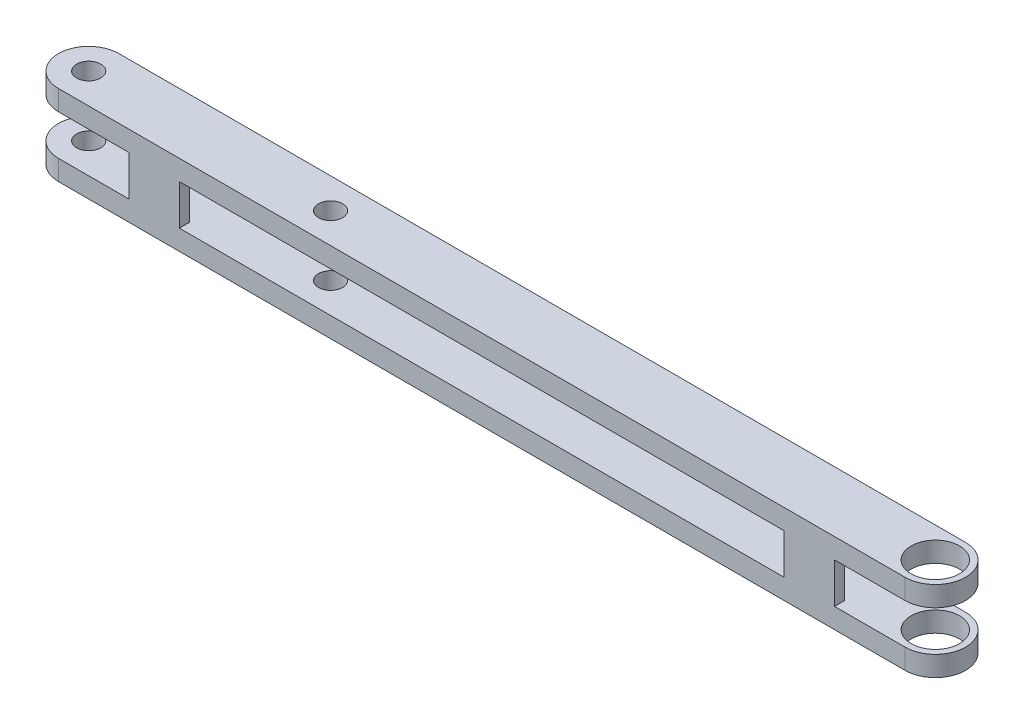
from build123d import *

# Parameters (mm, degrees)
EXTRUDE_1_DEPTH     = 20
SKETCH_2_W          = 150
SKETCH_2_H          = 10
CUT_EXTRUDE_3_DEPTH = 116.244305716
SKETCH_3_W          = 25
SKETCH_3_H          = 10
CUT_EXTRUDE_4_DEPTH = 116.244305716
SKETCH_4_W          = 10
SKETCH_4_H          = 10
CUT_EXTRUDE_5_DEPTH = 202.137390855
SKETCH_5_R          = 3
SKETCH_5_R_2        = 6
CUT_EXTRUDE_6_DEPTH = 115.509824906
SKETCH_6_R          = 3
CUT_EXTRUDE_7_DEPTH = 115.509824906


with BuildPart() as part:
    # 草图1 → 凸台-拉伸1 (new body)
    with BuildSketch(Plane(origin=(0, 0, 0), x_dir=(1, 0, 0), z_dir=(0, 1, 0))):
        with BuildLine():
            Line((-105, 7.5), (105, 7.5))
            ThreePointArc((105, 7.5), (112.5, 0), (105, -7.5))
            Line((105, -7.5), (-105, -7.5))
            ThreePointArc((-105, -7.5), (-112.5, 0), (-105, 7.5))
        make_face()
    extrude(amount=EXTRUDE_1_DEPTH)

    # 草图2 → 切除-拉伸3 (cut, through all)
    with BuildSketch(Plane(origin=(0, 0, -7.5), x_dir=(-1, 0, 0), z_dir=(0, 0, -1))):
        with Locations((0, 10)):
            Rectangle(SKETCH_2_W, SKETCH_2_H)
    extrude(amount=-CUT_EXTRUDE_3_DEPTH, mode=Mode.SUBTRACT)

    # 草图3 → 切除-拉伸4 (cut, through all)
    with BuildSketch(Plane(origin=(0, 0, -7.5), x_dir=(-1, 0, 0), z_dir=(0, 0, -1))):
        with Locations((100, 10)):
            Rectangle(SKETCH_3_W, SKETCH_3_H)
        with Locations((-100, 10)):
            Rectangle(SKETCH_3_W, SKETCH_3_H)
    extrude(amount=-CUT_EXTRUDE_4_DEPTH, mode=Mode.SUBTRACT)

    # 草图4 → 切除-拉伸5 (cut, through all)
    with BuildSketch(Plane.ZY.offset(87.5)):
        with Locations((0, 10)):
            Rectangle(SKETCH_4_W, SKETCH_4_H)
    extrude(amount=-CUT_EXTRUDE_5_DEPTH, mode=Mode.SUBTRACT)

    # 草图5 → 切除-拉伸6 (cut, through all)
    with BuildSketch(Plane(origin=(0, 20, 0), x_dir=(1, 0, 0), z_dir=(0, 1, 0))):
        with Locations(Location((-105, 0, 0), (0, 0, 270))):
            Circle(SKETCH_5_R)
        with Locations(Location((105, 0, 0), (0, 0, 270))):
            Circle(SKETCH_5_R_2)
    extrude(amount=-CUT_EXTRUDE_6_DEPTH, mode=Mode.SUBTRACT)

    # 草图6 → 切除-拉伸7 (cut, through all)
    with BuildSketch(Plane(origin=(0, 20, 0), x_dir=(1, 0, 0), z_dir=(0, 1, 0))):
        with Locations(Location((-45, 0, 0), (0, 0, 270))):
            Circle(SKETCH_6_R)
    extrude(amount=-CUT_EXTRUDE_7_DEPTH, mode=Mode.SUBTRACT)


solid = part.part
